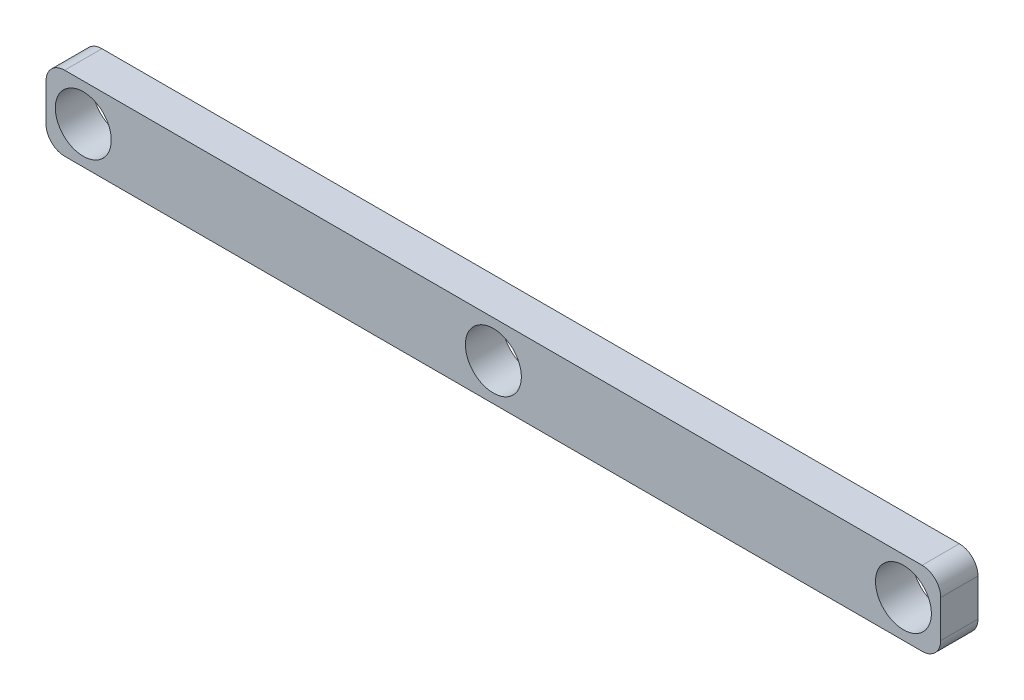
from build123d import *

# Parameters (mm, degrees)
SKETCH1_W           = 609.6
SKETCH1_H           = 50.8
BOSS_EXTRUDE1_DEPTH = 25.4
FILLET1_R           = 12.7
SKETCH4_R           = 19.05
CUT_EXTRUDE1_DEPTH  = 613.240116294
SKETCH5_R           = 19.05
CUT_EXTRUDE2_DEPTH  = 613.240116294
SKETCH2_R           = 19.05
CUT_EXTRUDE3_DEPTH  = 613.240116294


with BuildPart() as part:
    # Sketch1 → Boss-Extrude1 (new body)
    with BuildSketch(Plane.XY):
        with Locations((304.8, 25.4)):
            Rectangle(SKETCH1_W, SKETCH1_H)
    extrude(amount=BOSS_EXTRUDE1_DEPTH)

    # Fillet1
    fillet1_edges = [part.edges().sort_by_distance(p)[0] for p in [
        (0, 50.8, 12.7),
        (609.6, 50.8, 12.7),
        (609.6, 0, 12.7),
        (0, 0, 12.7),
    ]]
    fillet(fillet1_edges, radius=FILLET1_R)

    # Sketch4 → Cut-Extrude1 (cut, through all)
    with BuildSketch(Plane.XY.offset(25.4)):
        with Locations((584.2, 25.4)):
            Circle(SKETCH4_R)
    extrude(amount=-CUT_EXTRUDE1_DEPTH, mode=Mode.SUBTRACT)

    # Sketch5 → Cut-Extrude2 (cut, through all)
    with BuildSketch(Plane(origin=(0, 0, 0), x_dir=(-1, 0, 0), z_dir=(0, 0, -1))):
        with Locations((-304.8, 25.4)):
            Circle(SKETCH5_R)
    extrude(amount=-CUT_EXTRUDE2_DEPTH, mode=Mode.SUBTRACT)

    # Sketch2 → Cut-Extrude3 (cut, through all)
    with BuildSketch(Plane.XY.offset(25.4)):
        with Locations((25.4, 25.4)):
            Circle(SKETCH2_R)
    extrude(amount=-CUT_EXTRUDE3_DEPTH, mode=Mode.SUBTRACT)


solid = part.part
